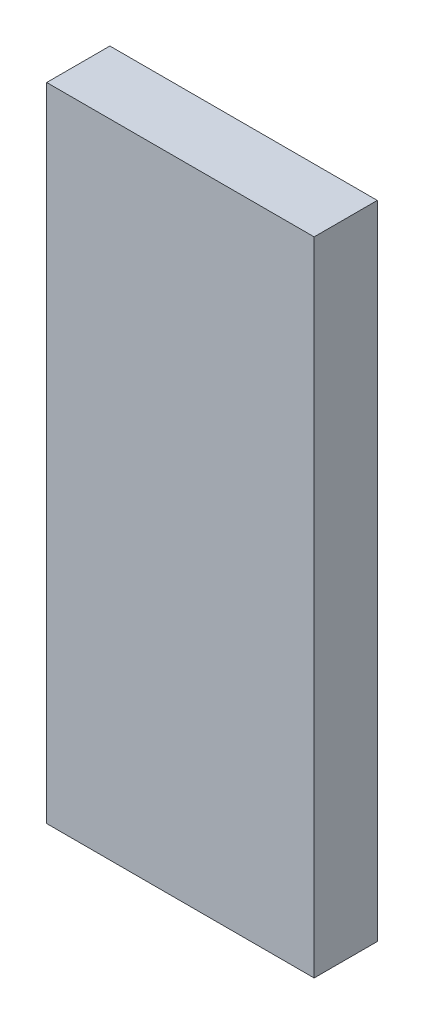
from build123d import *

# Parameters (mm, degrees)
SKETCH_1_W      = 63.5
SKETCH_1_H      = 152.4
EXTRUDE_1_DEPTH = 15


with BuildPart() as part:
    # 草图1 → 凸台-拉伸1 (new body)
    with BuildSketch(Plane.XY):
        with Locations((31.75, 76.2)):
            Rectangle(SKETCH_1_W, SKETCH_1_H)
    extrude(amount=EXTRUDE_1_DEPTH)


solid = part.part
